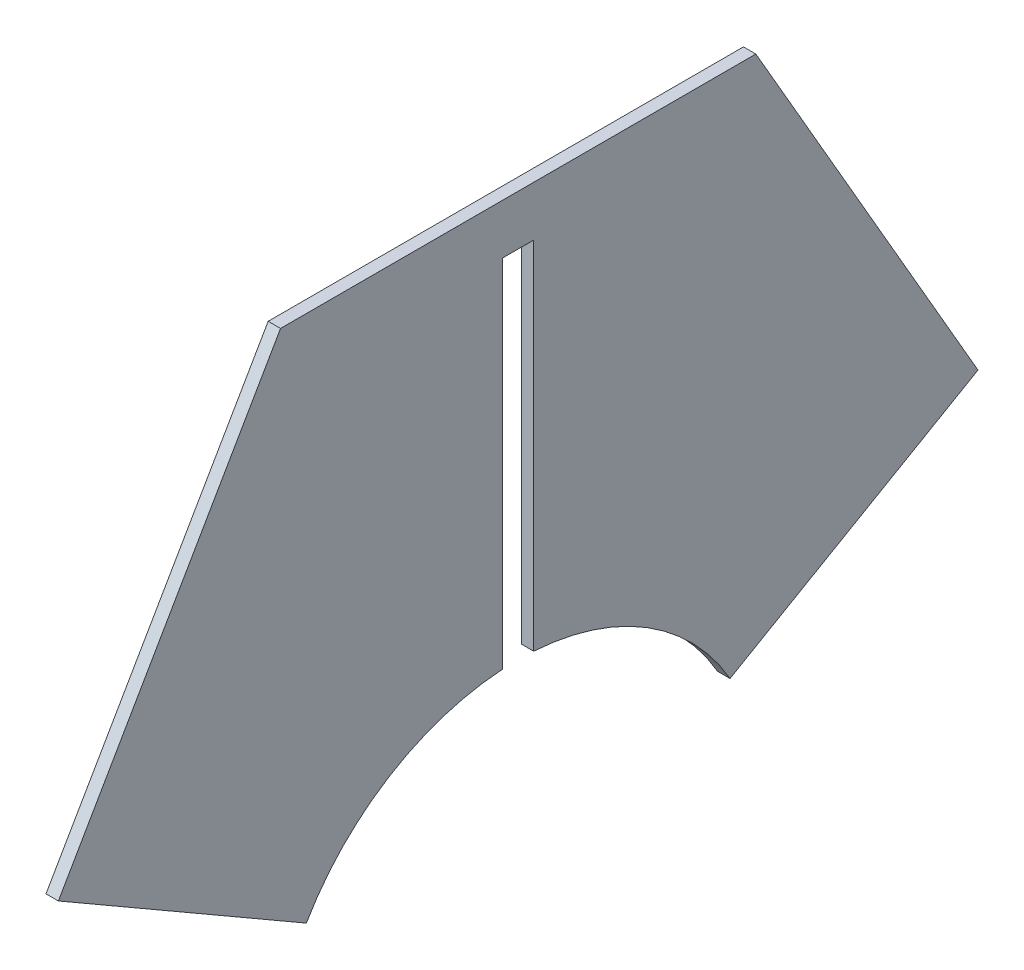
from build123d import *

# Parameters (mm, degrees)
BOSS_EXTRU_1_DEPTH = 4


with BuildPart() as part:
    # Esquisse1 → Boss.-Extru.1 (new body)
    with BuildSketch(Plane(origin=(0, 0, 0), x_dir=(0, 0, -1), z_dir=(1, 0, 0))):
        with BuildLine():
            Line((-68.416006899, 39.5), (-148.5, 85.736514975))
            Line((-148.5, 85.736514975), (-76.75644347, 210))
            Line((-76.75644347, 210), (76.75644347, 210))
            Line((76.75644347, 210), (148.5, 85.736514975))
            Line((148.5, 85.736514975), (68.416006899, 39.5))
            ThreePointArc((68.416006899, 39.5), (41.646346215, 67.13107959), (5, 78.841613378))
            Line((5, 78.841613378), (5, 193.841613378))
            Line((5, 193.841613378), (-5, 193.841613378))
            Line((-5, 193.841613378), (-5, 78.841613378))
            ThreePointArc((-5, 78.841613378), (-41.646346215, 67.13107959), (-68.416006899, 39.5))
        make_face()
    extrude(amount=BOSS_EXTRU_1_DEPTH)


solid = part.part
